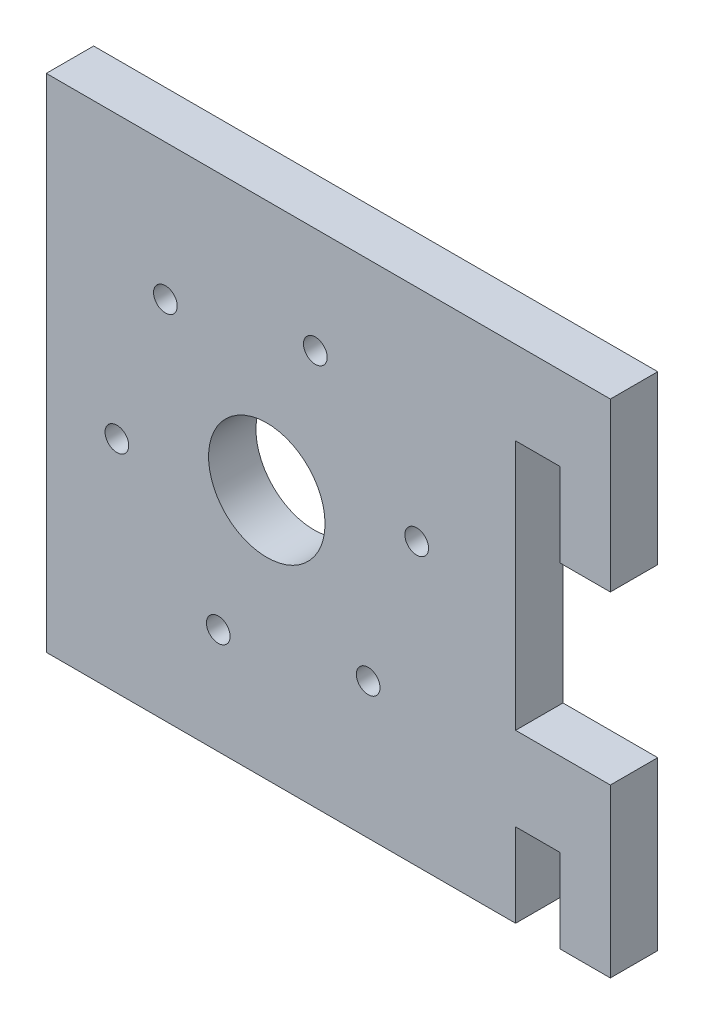
from build123d import *

# Parameters (mm, degrees)
SKETCH1_W           = 57.15
SKETCH1_H           = 50.8
BOSS_EXTRUDE1_DEPTH = 4.800000052
CUT_EXTRUDE4_DEPTH  = 77.614636333
SKETCH7_R           = 5.9
CUT_EXTRUDE6_DEPTH  = 100.346049289
SKETCH10_R          = 1.2
CUT_EXTRUDE9_DEPTH  = 100.346049289
SKETCH11_W          = 4.500000144
SKETCH11_H          = 8.466666667
CUT_EXTRUDE10_DEPTH = 77.614636333
CUT_EXTRUDE11_DEPTH = 77.614636333


with BuildPart() as part:
    # Sketch1 → Boss-Extrude1 (new body)
    with BuildSketch(Plane.XY):
        with Locations((28.575, 25.4)):
            Rectangle(SKETCH1_W, SKETCH1_H)
    extrude(amount=BOSS_EXTRUDE1_DEPTH)

    # Sketch5 → Cut-Extrude4 (cut, through all)
    with BuildSketch(Plane.XY.offset(4.800000052)):
        Polygon((52.349999948, 25.4), (57.15, 16.933333333), (57.15, 33.866666667), align=None)
        Polygon((47.549999896, 16.933333333), (57.15, 16.933333333), (52.349999948, 25.4), align=None)
        Polygon((47.549999896, 33.866666667), (47.549999896, 16.933333333), (52.349999948, 25.4), align=None)
        Polygon((52.349999948, 25.4), (57.15, 33.866666667), (47.549999896, 33.866666667), align=None)
    extrude(amount=-CUT_EXTRUDE4_DEPTH, mode=Mode.SUBTRACT)

    # Sketch7 → Cut-Extrude6 (cut, through all)
    with BuildSketch(Plane(origin=(60.342507963, 78.774229552, 4.800000052), x_dir=(0, 1, 0), z_dir=(0, 0, 1))):
        with Locations(Location((-53.374229552, 38.000051, 0), (0, 0, 270))):
            Circle(SKETCH7_R)
    extrude(amount=-CUT_EXTRUDE6_DEPTH, mode=Mode.SUBTRACT)

    # Sketch10 → Cut-Extrude9 (cut, through all)
    with BuildSketch(Plane(origin=(60.342507963, 78.774229552, 4.800000052), x_dir=(0, 1, 0), z_dir=(0, 0, 1))):
        with Locations(Location((-64.981804426, 27.728040216, 0), (0, 0, 270))):
            Circle(SKETCH10_R)
        with Locations(Location((-56.466264402, 53.188511109, 0), (0, 0, 270))):
            Circle(SKETCH10_R)
        with Locations(Location((-68.073839276, 42.916500326, 0), (0, 0, 270))):
            Circle(SKETCH10_R)
        with Locations(Location((-50.282194703, 22.811590891, 0), (0, 0, 270))):
            Circle(SKETCH10_R)
        with Locations(Location((-38.674619828, 33.083601674, 0), (0, 0, 270))):
            Circle(SKETCH10_R)
        with Locations(Location((-41.766654678, 48.272061784, 0), (0, 0, 270))):
            Circle(SKETCH10_R)
    extrude(amount=-CUT_EXTRUDE9_DEPTH, mode=Mode.SUBTRACT)

    # Sketch11 → Cut-Extrude10 (cut, through all)
    with BuildSketch(Plane.XY.offset(4.800000052)):
        with Locations((49.799999968, 4.233333334)):
            Rectangle(SKETCH11_W, SKETCH11_H)
    extrude(amount=-CUT_EXTRUDE10_DEPTH, mode=Mode.SUBTRACT)

    # Sketch12 → Cut-Extrude11 (cut, through all)
    with BuildSketch(Plane.XY.offset(4.800000052)):
        Polygon((49.799999968, 38.1), (47.549999896, 33.866666667), (52.05000004, 33.866666667), align=None)
        Polygon((47.549999896, 42.333333333), (47.549999896, 33.866666667), (49.799999968, 38.1), align=None)
        Polygon((49.799999968, 38.1), (52.05000004, 33.866666667), (52.05000004, 42.333333333), align=None)
        Polygon((52.05000004, 42.333333333), (47.549999896, 42.333333333), (49.799999968, 38.1), align=None)
    extrude(amount=-CUT_EXTRUDE11_DEPTH, mode=Mode.SUBTRACT)


solid = part.part
